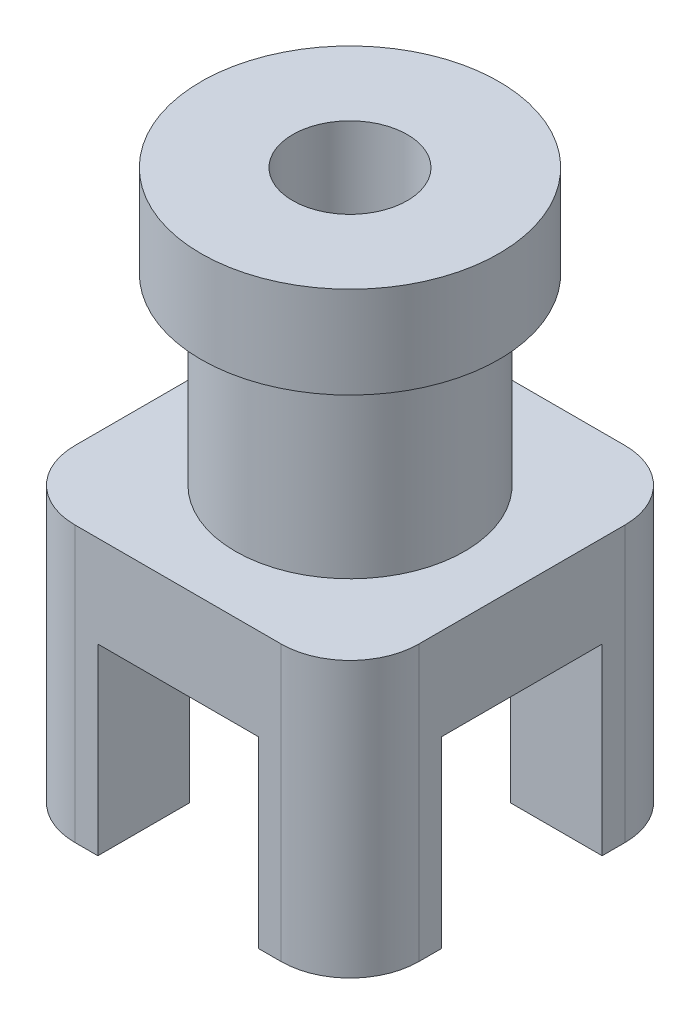
from build123d import *

# Parameters (mm, degrees)
CROQUIS2_W              = 150
CROQUIS2_H              = 150
SALIENTE_EXTRUIR2_DEPTH = 40
CROQUIS3_W              = 40
CROQUIS3_H              = 40
SALIENTE_EXTRUIR3_DEPTH = 80
CROQUIS4_R              = 50
SALIENTE_EXTRUIR4_DEPTH = 120
CROQUIS5_R              = 25
CORTAR_EXTRUIR1_DEPTH   = 221
REDONDEO1_R             = 30
CROQUIS6_R              = 65
SALIENTE_EXTRUIR5_DEPTH = 40
CROQUIS7_R              = 25
CORTAR_EXTRUIR2_DEPTH   = 125


with BuildPart() as part:
    # Croquis2 → Saliente-Extruir2 (new body)
    with BuildSketch(Plane(origin=(0, 0, 0), x_dir=(1, 0, 0), z_dir=(0, 1, 0))):
        Rectangle(CROQUIS2_W, CROQUIS2_H)
    extrude(amount=SALIENTE_EXTRUIR2_DEPTH)

    # Croquis3 → Saliente-Extruir3 (add)
    with BuildSketch(Plane.XZ):
        with Locations((-55, 55)):
            Rectangle(CROQUIS3_W, CROQUIS3_H)
        with Locations((55, 55)):
            Rectangle(CROQUIS3_W, CROQUIS3_H)
        with Locations((-55, -55)):
            Rectangle(CROQUIS3_W, CROQUIS3_H)
        with Locations((55, -55)):
            Rectangle(CROQUIS3_W, CROQUIS3_H)
    extrude(amount=SALIENTE_EXTRUIR3_DEPTH)

    # Croquis4 → Saliente-Extruir4 (add)
    with BuildSketch(Plane(origin=(0, 40, 0), x_dir=(1, 0, 0), z_dir=(0, 1, 0))):
        with Locations(Location((0, 0, 0), (0, 0, 270))):
            Circle(CROQUIS4_R)
    extrude(amount=SALIENTE_EXTRUIR4_DEPTH)

    # Croquis5 → Cortar-Extruir1 (cut)
    with BuildSketch(Plane(origin=(0, 160, 0), x_dir=(1, 0, 0), z_dir=(0, 1, 0))):
        with Locations(Location((0, 0, 0), (0, 0, 270))):
            Circle(CROQUIS5_R)
    extrude(amount=-CORTAR_EXTRUIR1_DEPTH, mode=Mode.SUBTRACT)

    # Redondeo1
    redondeo1_edges = [part.edges().sort_by_distance(p)[0] for p in [
        (-75, -20, -75),
        (75, -20, -75),
        (75, -20, 75),
        (-75, -20, 75),
    ]]
    fillet(redondeo1_edges, radius=REDONDEO1_R)

    # Croquis6 → Saliente-Extruir5 (add)
    with BuildSketch(Plane(origin=(0, 160, 0), x_dir=(1, 0, 0), z_dir=(0, 1, 0))):
        with Locations(Location((0, 0, 0), (0, 0, 270))):
            Circle(CROQUIS6_R)
    extrude(amount=-SALIENTE_EXTRUIR5_DEPTH)

    # Croquis7 → Cortar-Extruir2 (cut)
    with BuildSketch(Plane(origin=(0, 160, 0), x_dir=(1, 0, 0), z_dir=(0, 1, 0))):
        with Locations(Location((0, 0, 0), (0, 0, 270))):
            Circle(CROQUIS7_R)
    extrude(amount=-CORTAR_EXTRUIR2_DEPTH, mode=Mode.SUBTRACT)


solid = part.part
